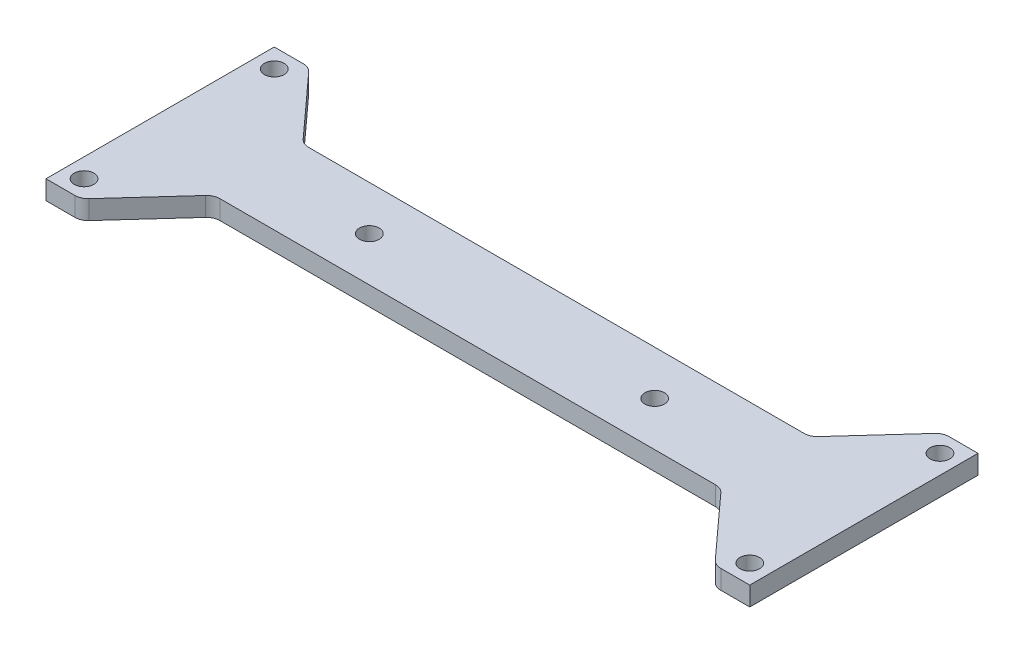
from build123d import *

# Parameters (mm, degrees)
SKETCH_1_W          = 111
SKETCH_1_H          = 36
SKETCH_1_R          = 1.55
EXTRUDE_1_DEPTH     = 3
CUT_EXTRUDE_1_DEPTH = 59.423026282
FILLET_2_R          = 2.1


with BuildPart() as part:
    # ｽｹｯﾁ1 → ﾎﾞｽ - 押し出し1 (new body)
    with BuildSketch(Plane(origin=(0, 0, 0), x_dir=(1, 0, 0), z_dir=(0, 1, 0))):
        Rectangle(SKETCH_1_W, SKETCH_1_H)
        with Locations(Location((-52.5, 15, 0), (0, 0, 270))):
            Circle(SKETCH_1_R, mode=Mode.SUBTRACT)
        with Locations(Location((-52.5, -15, 0), (0, 0, 270))):
            Circle(SKETCH_1_R, mode=Mode.SUBTRACT)
        with Locations(Location((52.5, -15, 0), (0, 0, 270))):
            Circle(SKETCH_1_R, mode=Mode.SUBTRACT)
        with Locations(Location((52.5, 15, 0), (0, 0, 270))):
            Circle(SKETCH_1_R, mode=Mode.SUBTRACT)
        with Locations(Location((-22.5, 0, 0), (0, 0, 270))):
            Circle(SKETCH_1_R, mode=Mode.SUBTRACT)
        with Locations(Location((22.5, 0, 0), (0, 0, 270))):
            Circle(SKETCH_1_R, mode=Mode.SUBTRACT)
    extrude(amount=EXTRUDE_1_DEPTH)

    # ｽｹｯﾁ2 → ｶｯﾄ - 押し出し1 (cut, through all)
    with BuildSketch(Plane(origin=(0, 3, 0), x_dir=(1, 0, 0), z_dir=(0, 1, 0))):
        Polygon((-50, 18), (-40, 7), (40, 7), (50, 18), align=None)
        Polygon((50, -18), (-50, -18), (-40, -7), (40, -7), align=None)
    extrude(amount=-CUT_EXTRUDE_1_DEPTH, mode=Mode.SUBTRACT)

    # ﾌｨﾚｯﾄ2
    fillet_2_edges = [part.edges().sort_by_distance(p)[0] for p in [
        (-50, 1.5, -18),
        (50, 1.5, -18),
        (40, 1.5, -7),
        (-40, 1.5, -7),
        (40, 1.5, 7),
        (50, 1.5, 18),
        (-50, 1.5, 18),
        (-40, 1.5, 7),
    ]]
    fillet(fillet_2_edges, radius=FILLET_2_R)


solid = part.part
